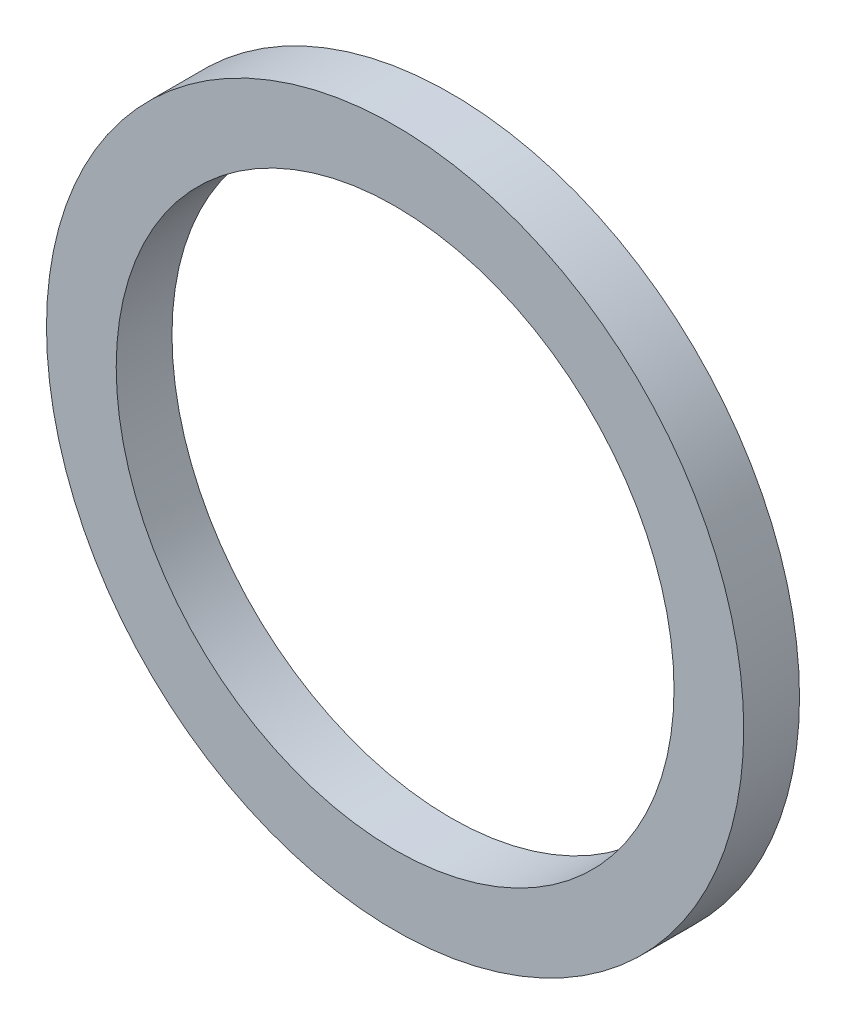
from build123d import *

# Parameters (mm, degrees)
SKETCH_1_R      = 1.25
SKETCH_1_R_2    = 1
EXTRUDE_2_DEPTH = 0.2


with BuildPart() as part:
    # Эскиз1 → Бобышка-Вытянуть2 (new body)
    with BuildSketch(Plane.XY):
        Circle(SKETCH_1_R)
        Circle(SKETCH_1_R_2, mode=Mode.SUBTRACT)
    extrude(amount=EXTRUDE_2_DEPTH)


solid = part.part
